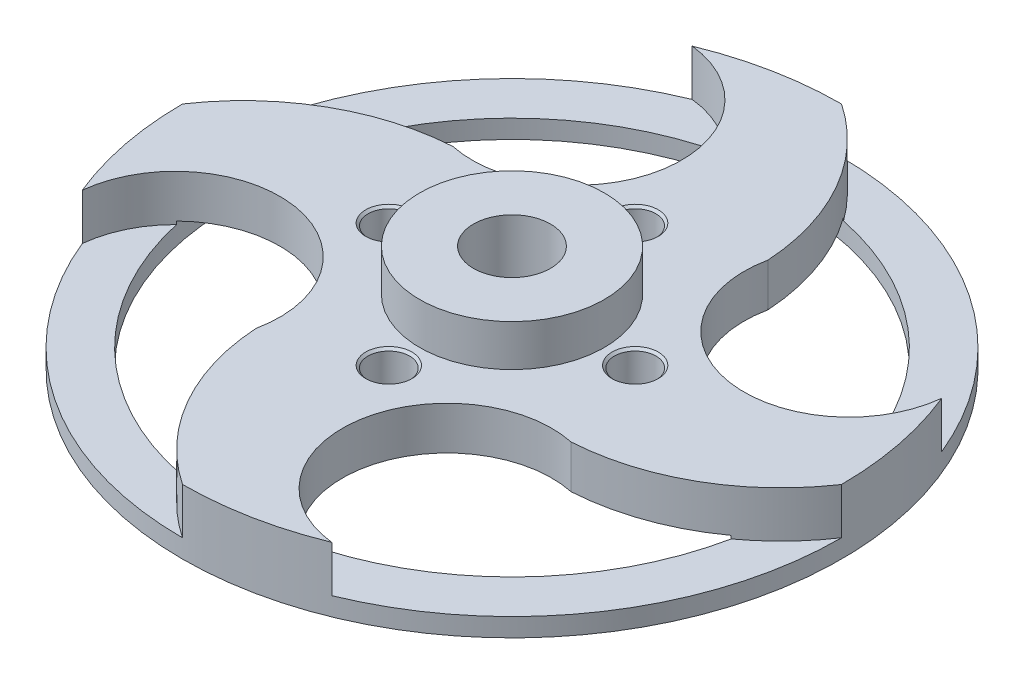
from build123d import *

# Parameters (mm, degrees)
SKETCH_4_R                = 21.4
EXTRUDE_2_DEPTH           = 1.2
EXTRUDE_5_DEPTH           = 4.2
SKETCH_7_R                = 18.25
CUT_EXTRUDE_2_DEPTH       = 1.4
SKETCH_9_R                = 6
EXTRUDE_6_DEPTH           = 2.7
SKETCH_10_R               = 2.5
CUT_EXTRUDE_3_DEPTH       = 32.040779629
HOLE_WIZARD_1_D           = 2.7
HOLE_WIZARD_1_CSINK_D     = 3
HOLE_WIZARD_1_CSINK_ANGLE = 90


with BuildPart() as part:
    # 草图4 → 凸台-拉伸2 (new body)
    with BuildSketch(Plane(origin=(0, 0, 0), x_dir=(1, 0, 0), z_dir=(0, 1, 0))):
        with Locations(Location((0, 0, 0), (0, 0, 270))):
            Circle(SKETCH_4_R)
    extrude(amount=EXTRUDE_2_DEPTH)

    # 草图5 → 凸台-拉伸5 (add)
    with BuildSketch(Plane(origin=(0, 0, 0), x_dir=(1, 0, 0), z_dir=(0, 1, 0))):
        with BuildLine():
            ThreePointArc((0, 21.4), (-4.129005127, 20.997888386), (-8.102840074, 19.806665109))
            ThreePointArc((-8.102840074, 19.806665109), (-2.113798114, 11.981054753), (-10.229363001, 6.391206133))
            ThreePointArc((-10.229363001, 6.391206133), (-16.561312382, 4.500574676), (-21.4, 0))
            ThreePointArc((-21.4, 0), (-20.997888386, -4.129005127), (-19.806665109, -8.102840074))
            ThreePointArc((-19.806665109, -8.102840074), (-11.981054753, -2.113798114), (-6.391206133, -10.229363001))
            ThreePointArc((-6.391206133, -10.229363001), (-4.500574676, -16.561312382), (0, -21.4))
            ThreePointArc((0, -21.4), (4.129005127, -20.997888386), (8.102840074, -19.806665109))
            ThreePointArc((8.102840074, -19.806665109), (2.113798114, -11.981054753), (10.229363001, -6.391206133))
            ThreePointArc((10.229363001, -6.391206133), (16.561312382, -4.500574676), (21.4, 0))
            ThreePointArc((21.4, 0), (20.997888386, 4.129005127), (19.806665109, 8.102840074))
            ThreePointArc((19.806665109, 8.102840074), (11.981054753, 2.113798114), (6.391206133, 10.229363001))
            ThreePointArc((6.391206133, 10.229363001), (4.500574676, 16.561312382), (0, 21.4))
        make_face()
    extrude(amount=EXTRUDE_5_DEPTH)

    # 草图7 → 切除-拉伸2 (cut)
    with BuildSketch(Plane.XZ):
        with Locations(Location((0, 0, 0), (0, 0, 270))):
            Circle(SKETCH_7_R)
    extrude(amount=-CUT_EXTRUDE_2_DEPTH, mode=Mode.SUBTRACT)

    # 草图9 → 凸台-拉伸6 (add)
    with BuildSketch(Plane(origin=(0, 4.2, 0), x_dir=(1, 0, 0), z_dir=(0, 1, 0))):
        with Locations(Location((0, 0, 0), (0, 0, 90))):
            Circle(SKETCH_9_R)
    extrude(amount=EXTRUDE_6_DEPTH)

    # 草图10 → 切除-拉伸3 (cut, through all)
    with BuildSketch(Plane(origin=(0, 6.9, 0), x_dir=(1, 0, 0), z_dir=(0, 1, 0))):
        with Locations(Location((0, 0, 0), (0, 0, 270))):
            Circle(SKETCH_10_R)
    extrude(amount=-CUT_EXTRUDE_3_DEPTH, mode=Mode.SUBTRACT)

    # 打孔尺寸(%根据)内六角花形半沉头螺钉的类型1 (through all)
    with Locations(Plane(origin=(-8, 4.2, 0), x_dir=(0, 0, 1), z_dir=(0, 1, 0))):
        with Locations((0, 0), (-8, 8), (0, 16), (8, 8)):
            CounterSinkHole(HOLE_WIZARD_1_D / 2, HOLE_WIZARD_1_CSINK_D / 2, counter_sink_angle=HOLE_WIZARD_1_CSINK_ANGLE)


solid = part.part
